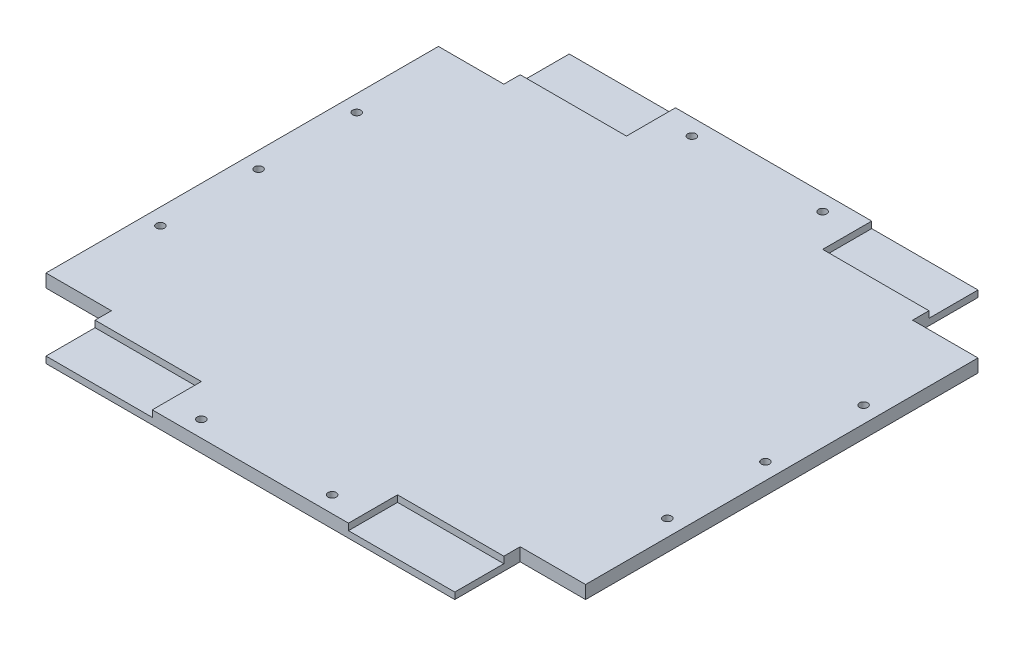
from build123d import *

# Parameters (mm, degrees)
BOSS_EXTRUDE1_DEPTH     = 8
SKETCH2_R               = 2.5
CUT_EXTRUDE1_DEPTH      = 8
SKETCH3_W               = 65
SKETCH3_H               = 30
CUT_EXTRUDE2_DEPTH      = 4
MIRROR2_COPY_1_SKETCH_W = 65
MIRROR2_COPY_1_SKETCH_H = 30
MIRROR2_COPY_1_DEPTH    = 4


with BuildPart() as part:
    # Sketch1 → Boss-Extrude1 (new body)
    with BuildSketch(Plane(origin=(0, 0, 0), x_dir=(1, 0, 0), z_dir=(0, 1, 0))):
        Polygon((125, 160), (-125, 160), (-125, 120), (-165, 120), (-165, -120), (-125, -120), (-125, -160), (125, -160), (125, -120), (165, -120), (165, 120), (125, 120), align=None)
    extrude(amount=BOSS_EXTRUDE1_DEPTH)

    # Sketch2 → Cut-Extrude1 (cut)
    with BuildSketch(Plane(origin=(0, 8, 0), x_dir=(1, 0, 0), z_dir=(0, 1, 0))):
        with Locations(Location((155, 60, 0), (0, 0, 270))):
            Circle(SKETCH2_R)
        with Locations(Location((155, 0, 0), (0, 0, 270))):
            Circle(SKETCH2_R)
        with Locations(Location((155, -60, 0), (0, 0, 270))):
            Circle(SKETCH2_R)
        with Locations(Location((40, -150, 0), (0, 0, 270))):
            Circle(SKETCH2_R)
        with Locations(Location((-40, -150, 0), (0, 0, 270))):
            Circle(SKETCH2_R)
        with Locations(Location((-155, -60, 0), (0, 0, 90))):
            Circle(SKETCH2_R)
        with Locations(Location((-155, 0, 0), (0, 0, 90))):
            Circle(SKETCH2_R)
        with Locations(Location((-155, 60, 0), (0, 0, 90))):
            Circle(SKETCH2_R)
        with Locations(Location((-40, 150, 0), (0, 0, 90))):
            Circle(SKETCH2_R)
        with Locations(Location((40, 150, 0), (0, 0, 90))):
            Circle(SKETCH2_R)
    extrude(amount=-CUT_EXTRUDE1_DEPTH, mode=Mode.SUBTRACT)

    # Sketch3 → Cut-Extrude2 (cut)
    with BuildSketch(Plane(origin=(0, 8, 0), x_dir=(1, 0, 0), z_dir=(0, 1, 0))):
        with Locations((-92.5, 145)):
            Rectangle(SKETCH3_W, SKETCH3_H)
    cut_extrude2 = extrude(amount=-CUT_EXTRUDE2_DEPTH, mode=Mode.SUBTRACT)

    # Mirror1: Cut-Extrude2 across plane
    add(cut_extrude2.mirror(Plane(origin=(0, 0, 0), x_dir=(1, 0, 0), z_dir=(0, 0, -1))), mode=Mode.SUBTRACT)

    # Mirror2: Cut-Extrude2 across plane
    add(cut_extrude2.mirror(Plane.ZY), mode=Mode.SUBTRACT)

    # Mirror2 copy 1 sketch → Mirror2 copy 1 (cut)
    with BuildSketch(Plane(origin=(0, 8, 0), x_dir=(-1, 0, 0), z_dir=(0, 1, 0))):
        with Locations((-92.5, 145)):
            Rectangle(MIRROR2_COPY_1_SKETCH_W, MIRROR2_COPY_1_SKETCH_H)
    extrude(amount=-MIRROR2_COPY_1_DEPTH, mode=Mode.SUBTRACT)


solid = part.part
